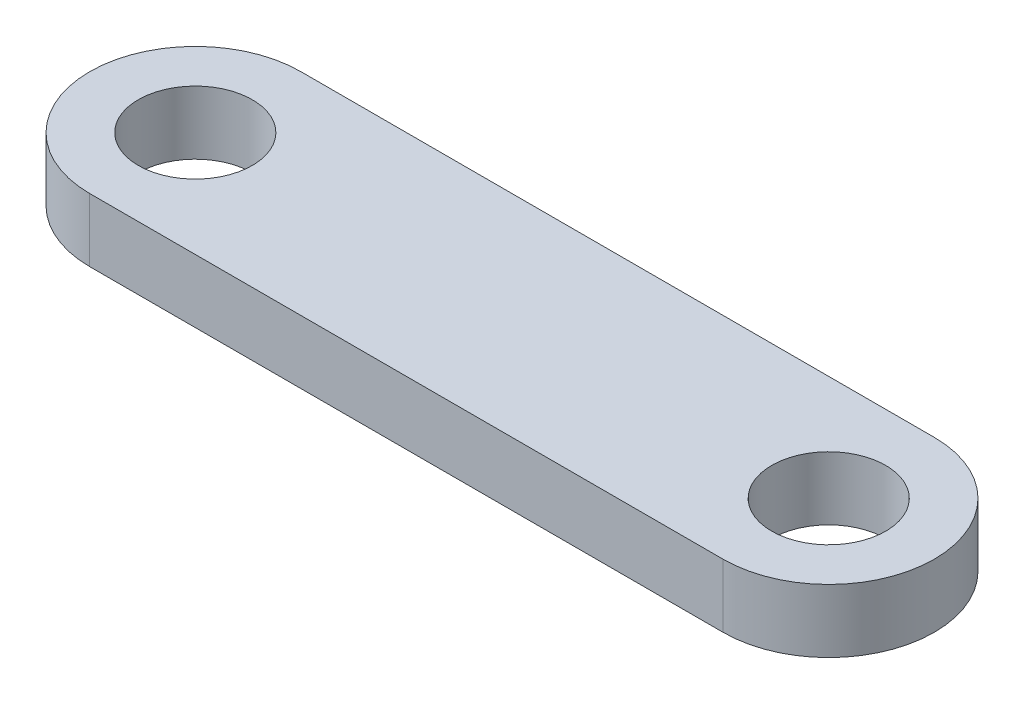
from build123d import *

# Parameters (mm, degrees)
SKETCH1_R           = 2.7
BOSS_EXTRUDE1_DEPTH = 3


with BuildPart() as part:
    # Sketch1 → Boss-Extrude1 (new body)
    with BuildSketch(Plane(origin=(0, 0, 0), x_dir=(1, 0, 0), z_dir=(0, 1, 0))):
        with BuildLine():
            Line((0, 5), (30, 5))
            ThreePointArc((30, 5), (35, 0), (30, -5))
            Line((30, -5), (0, -5))
            ThreePointArc((0, -5), (-5, 0), (0, 5))
        make_face()
        with Locations(Location((0, 0, 0), (0, 0, 270))):
            Circle(SKETCH1_R, mode=Mode.SUBTRACT)
        with Locations(Location((30, 0, 0), (0, 0, 270))):
            Circle(SKETCH1_R, mode=Mode.SUBTRACT)
    extrude(amount=BOSS_EXTRUDE1_DEPTH)


solid = part.part
